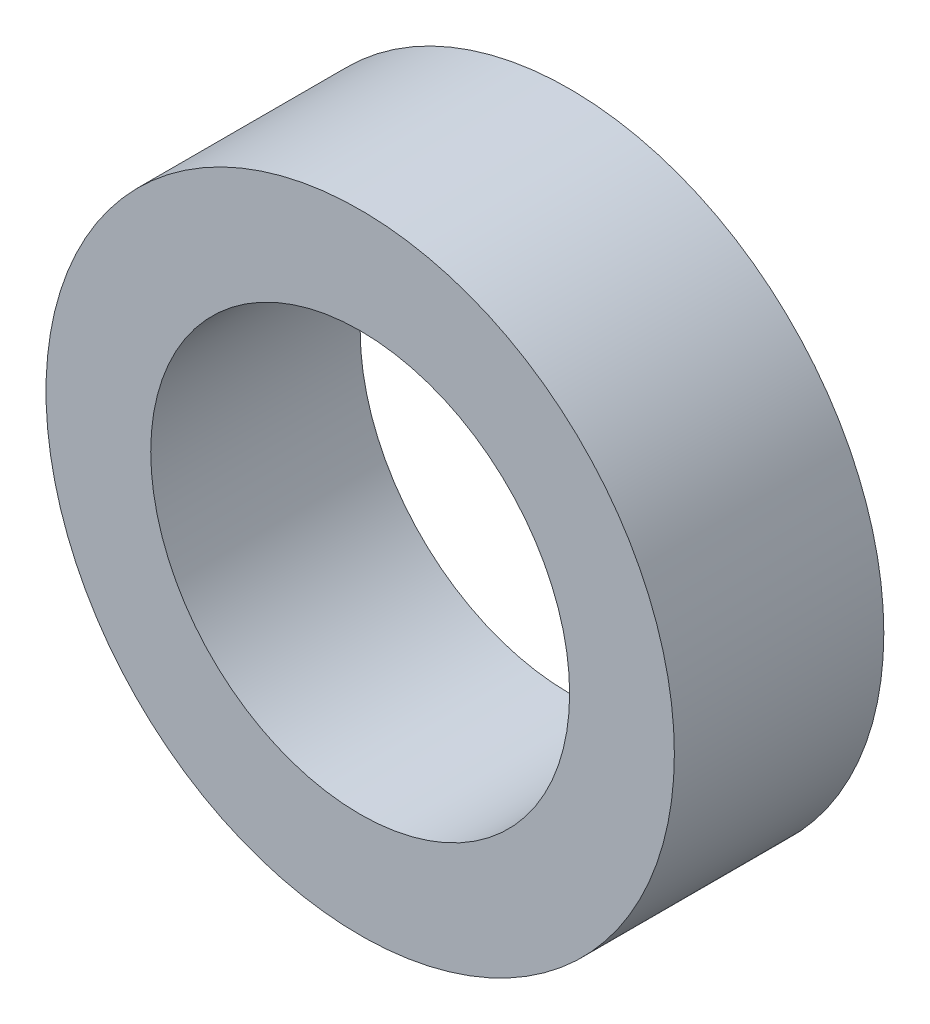
from build123d import *

# Parameters (mm, degrees)
SKETCH1_R           = 6
SKETCH1_R_2         = 4
BOSS_EXTRUDE1_DEPTH = 2


with BuildPart() as part:
    # Sketch1 → Boss-Extrude1 (new, symmetric)
    with BuildSketch(Plane.XY):
        Circle(SKETCH1_R)
        Circle(SKETCH1_R_2, mode=Mode.SUBTRACT)
    extrude(amount=BOSS_EXTRUDE1_DEPTH, both=True)


solid = part.part
